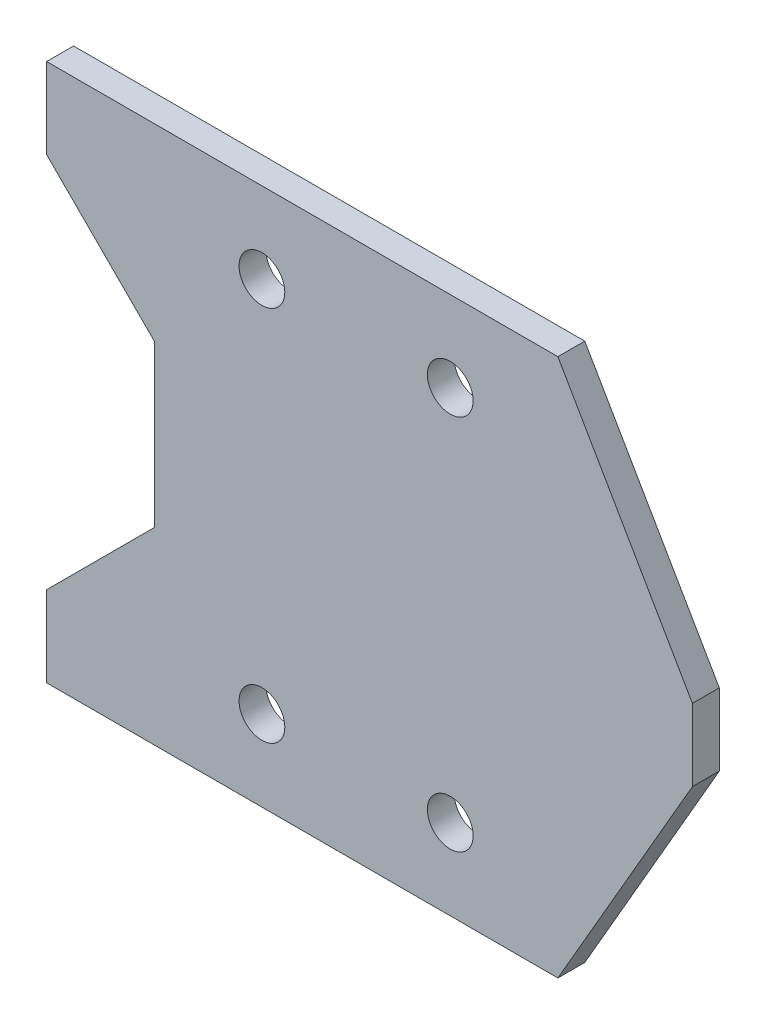
from build123d import *

# Parameters (mm, degrees)
SKIZZE1_R                       = 4.25
AUFSATZ_LINEAR_AUSTRAGEN1_DEPTH = 5


with BuildPart() as part:
    # Skizze1 → Aufsatz-Linear austragen1 (new body)
    with BuildSketch(Plane.XY):
        Polygon((0, 15), (0, -15), (-20, -35), (-20, -50), (75, -50), (100, -6.698729811), (100, 6.698729811), (75, 50), (-20, 50), (-20, 35), align=None)
        with Locations((20, 35)):
            Circle(SKIZZE1_R, mode=Mode.SUBTRACT)
        with Locations((55, 35)):
            Circle(SKIZZE1_R, mode=Mode.SUBTRACT)
        with Locations((20, -35)):
            Circle(SKIZZE1_R, mode=Mode.SUBTRACT)
        with Locations((55, -35)):
            Circle(SKIZZE1_R, mode=Mode.SUBTRACT)
    extrude(amount=AUFSATZ_LINEAR_AUSTRAGEN1_DEPTH)


solid = part.part
